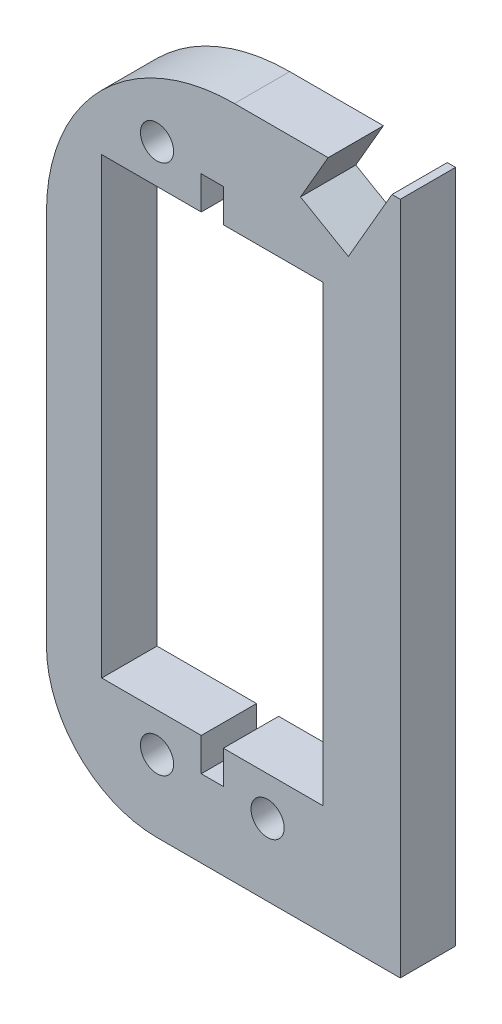
from build123d import *

# Parameters (mm, degrees)
ESQUISSE1_R        = 1.5
BOSS_EXTRU_1_DEPTH = 5
CONG_1_R           = 17
CONG_2_R           = 10


with BuildPart() as part:
    # Esquisse1 → Boss.-Extru.1 (new body)
    with BuildSketch(Plane.XY):
        Polygon((0, 0), (25, 0), (32, 0), (32, 61), (31.250785563, 61), (27.30740989, 54.169872981), (22.977282871, 56.669872981), (25.477282871, 61), (15, 61), (0, 61), align=None)
        with Locations((10, 54.5)):
            Circle(ESQUISSE1_R, mode=Mode.SUBTRACT)
        with Locations((20, 6.5)):
            Circle(ESQUISSE1_R, mode=Mode.SUBTRACT)
        with Locations(Location((10, 6.5, 0), (0, 0, 180))):
            Circle(ESQUISSE1_R, mode=Mode.SUBTRACT)
        Polygon((14, 51), (5, 51), (5, 10), (14, 10), (14, 7), (16, 7), (16, 10), (25, 10), (25, 51), (16, 51), (16, 54), (14, 54), align=None, mode=Mode.SUBTRACT)
    extrude(amount=BOSS_EXTRU_1_DEPTH)

    # Congé1
    cong_1_edges = [part.edges().sort_by_distance(p)[0] for p in [
        (0, 61, 2.5),
    ]]
    fillet(cong_1_edges, radius=CONG_1_R)

    # Congé2
    cong_2_edges = [part.edges().sort_by_distance(p)[0] for p in [
        (0, 0, 2.5),
    ]]
    fillet(cong_2_edges, radius=CONG_2_R)


solid = part.part
